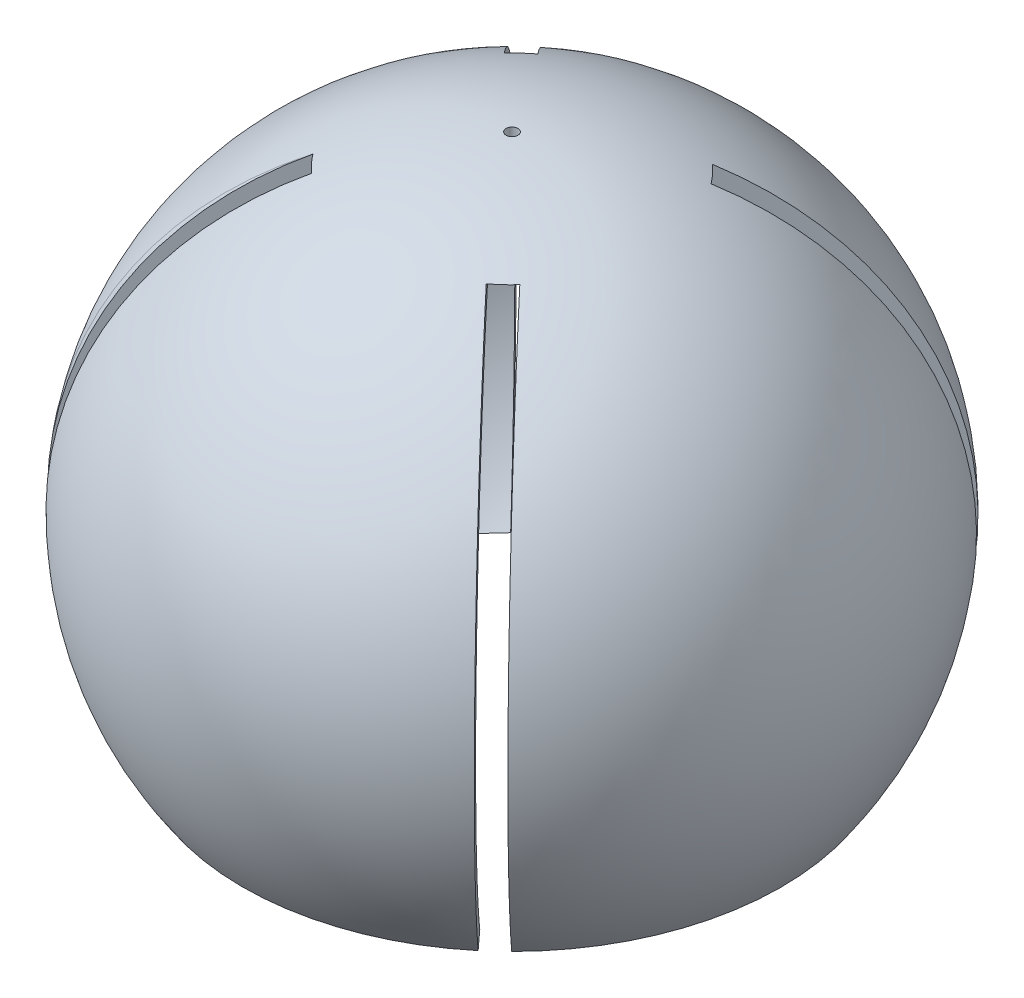
from build123d import *

# Parameters (mm, degrees)
CUT_EXTRUDE1_DEPTH = 25
SKETCH6_W          = 80.908827019
SKETCH6_H          = 24.076414011
CUT_EXTRUDE4_DEPTH = 30
SKETCH7_R          = 0.5
CUT_EXTRUDE5_DEPTH = 30


with BuildPart() as part:
    # Sketch1 → Revolve1 (revolve)
    with BuildSketch(Plane.XY):
        with BuildLine():
            Line((0, 27.704362144), (0, -27.751291116))
            ThreePointArc((0, -27.751291116), (-27.72782663, -0.023464486), (0, 27.704362144))
        make_face()
    revolve(axis=Axis((0, 27.704362144, 0), (0, -1, 0)))

    # Sketch3 → Cut-Extrude1 (cut, symmetric)
    with BuildSketch(Plane(origin=(0, 0, 0), x_dir=(1, 0, 0), z_dir=(0, 1, 0))):
        with BuildLine():
            Line((-17.956331074, 21.128240437), (0.063483755, 1.412787958))
            Line((0.063483755, 1.412787958), (19.778936235, 19.432602786))
            ThreePointArc((19.778936235, 19.432602786), (20.466903048, 18.706636503), (21.128240437, 17.956331074))
            Line((21.128240437, 17.956331074), (1.412787958, -0.063483755))
            Line((1.412787958, -0.063483755), (19.432602786, -19.778936235))
            ThreePointArc((19.432602786, -19.778936235), (18.706636503, -20.466903048), (17.956331074, -21.128240437))
            Line((17.956331074, -21.128240437), (-0.063483755, -1.412787958))
            Line((-0.063483755, -1.412787958), (-19.778936235, -19.432602786))
            ThreePointArc((-19.778936235, -19.432602786), (-20.466903048, -18.706636503), (-21.128240437, -17.956331074))
            Line((-21.128240437, -17.956331074), (-1.412787958, 0.063483755))
            Line((-1.412787958, 0.063483755), (-19.432602786, 19.778936235))
            ThreePointArc((-19.432602786, 19.778936235), (-18.706636503, 20.466903048), (-17.956331074, 21.128240437))
        make_face()
    extrude(amount=CUT_EXTRUDE1_DEPTH, both=True, mode=Mode.SUBTRACT)

    # Sketch5 → Cut-Revolve1 (revolve, cut)
    with BuildSketch(Plane.XY):
        with BuildLine():
            Line((0, -26), (0, 0))
            Line((0, 0), (0, 26))
            ThreePointArc((0, 26), (-26, 0), (0, -26))
        make_face()
    revolve(axis=Axis((0, 31.630604592, 0), (0, -1, 0)), mode=Mode.SUBTRACT)

    # Sketch6 → Cut-Extrude4 (cut, symmetric)
    with BuildSketch(Plane.XY):
        with Locations((1.660442345, -28.038207006)):
            Rectangle(SKETCH6_W, SKETCH6_H)
    extrude(amount=CUT_EXTRUDE4_DEPTH, both=True, mode=Mode.SUBTRACT)

    # Sketch7 → Cut-Extrude5 (cut, symmetric)
    with BuildSketch(Plane(origin=(0, 0, 0), x_dir=(1, 0, 0), z_dir=(0, 1, 0))):
        with Locations(Location((0, 0, 0), (0, 0, 90))):
            Circle(SKETCH7_R)
    extrude(amount=CUT_EXTRUDE5_DEPTH, both=True, mode=Mode.SUBTRACT)


solid = part.part
